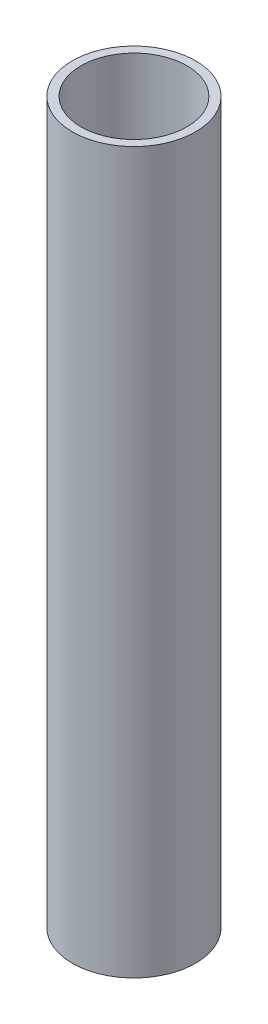
from build123d import *

# Parameters (mm, degrees)
SKETCH1_R           = 21.1
SKETCH1_R_2         = 18.15
BOSS_EXTRUDE1_DEPTH = 123.3


with BuildPart() as part:
    # Sketch1 → Boss-Extrude1 (new, symmetric)
    with BuildSketch(Plane(origin=(0, 0, 0), x_dir=(1, 0, 0), z_dir=(0, 1, 0))):
        with Locations(Location((0, 0, 0), (0, 0, 270))):
            Circle(SKETCH1_R)
        with Locations(Location((0, 0, 0), (0, 0, 270))):
            Circle(SKETCH1_R_2, mode=Mode.SUBTRACT)
    extrude(amount=BOSS_EXTRUDE1_DEPTH, both=True)


solid = part.part
